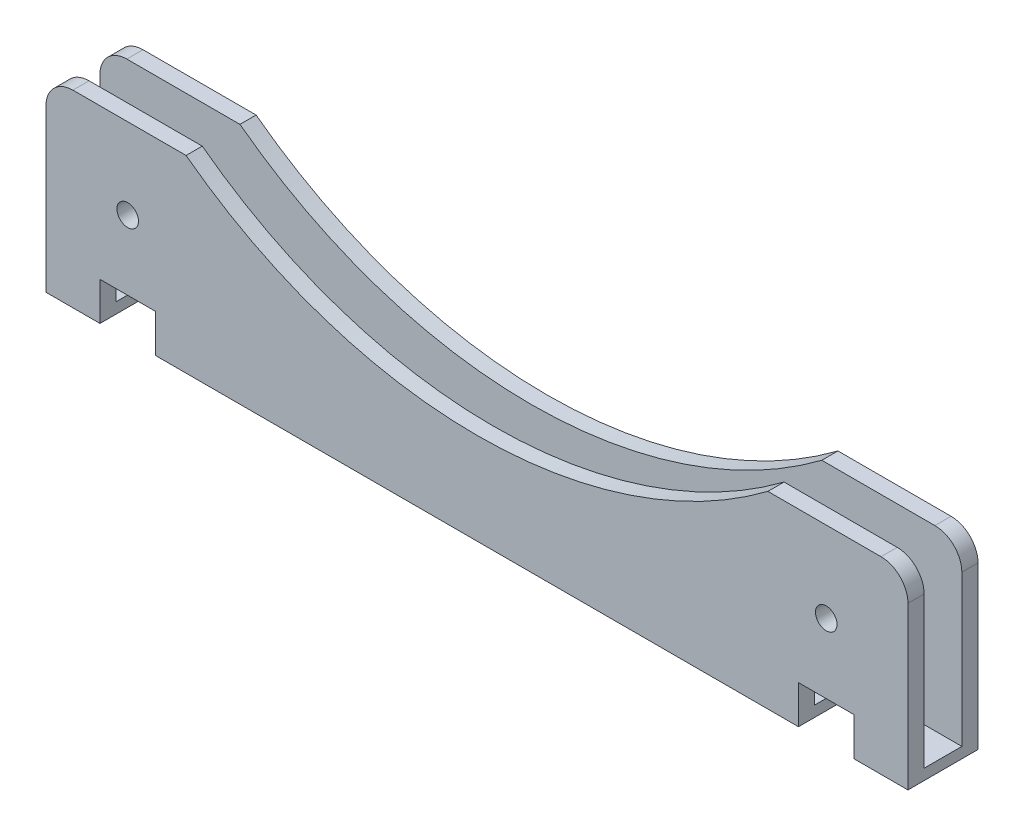
from build123d import *

# Parameters (mm, degrees)
SKETCH_1_R          = 2
EXTRUDE_1_DEPTH     = 13
SKETCH_2_W          = 7
SKETCH_2_H          = 34.84138361
CUT_EXTRUDE_1_DEPTH = 193.919672403
SKETCH_3_W          = 10.3
SKETCH_3_H          = 7.1
CUT_EXTRUDE_2_DEPTH = 60


with BuildPart() as part:
    # 草图1 → 凸台-拉伸1 (new body)
    with BuildSketch(Plane.XY):
        with BuildLine():
            Line((54, -72), (75, -72))
            ThreePointArc((75, -72), (78.535533906, -73.464466094), (80, -77))
            Line((80, -77), (80, -107))
            Line((80, -107), (-80, -107))
            Line((-80, -107), (-80, -77))
            ThreePointArc((-80, -77), (-78.535533906, -73.464466094), (-75, -72))
            Line((-75, -72), (-54, -72))
            ThreePointArc((-54, -72), (0, -90), (54, -72))
        make_face()
        with Locations(Location((-64.83247643, -87, 0), (0, 0, 180))):
            Circle(SKETCH_1_R, mode=Mode.SUBTRACT)
        with Locations(Location((64.83247643, -87, 0), (0, 0, 180))):
            Circle(SKETCH_1_R, mode=Mode.SUBTRACT)
    extrude(amount=EXTRUDE_1_DEPTH)

    # 草图2 → 切除-拉伸1 (cut, through all)
    with BuildSketch(Plane(origin=(80, 0, 0), x_dir=(0, 0, -1), z_dir=(1, 0, 0))):
        with Locations((-6.5, -87.579308195)):
            Rectangle(SKETCH_2_W, SKETCH_2_H)
    extrude(amount=-CUT_EXTRUDE_1_DEPTH, mode=Mode.SUBTRACT)

    # 草图3 → 切除-拉伸2 (cut)
    with BuildSketch(Plane.XY.offset(13)):
        with Locations((-64.83247643, -103.45)):
            Rectangle(SKETCH_3_W, SKETCH_3_H)
        with Locations((64.83247643, -103.45)):
            Rectangle(SKETCH_3_W, SKETCH_3_H)
    extrude(amount=-CUT_EXTRUDE_2_DEPTH, mode=Mode.SUBTRACT)


solid = part.part
